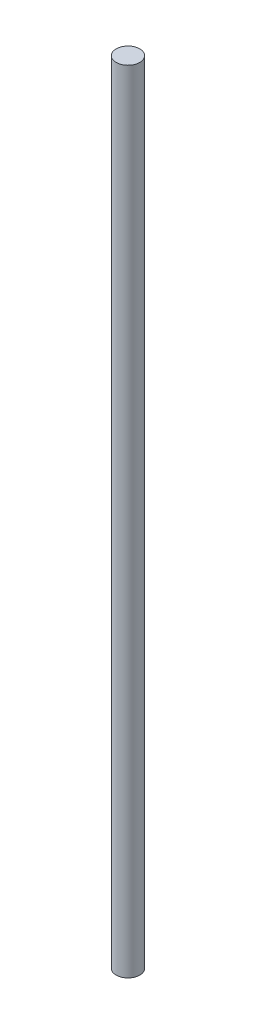
from build123d import *

# Parameters (mm, degrees)
SKETCH_1_R      = 1
EXTRUDE_1_DEPTH = 67


with BuildPart() as part:
    # 草图1 → 凸台-拉伸1 (new body)
    with BuildSketch(Plane(origin=(0, 0, 0), x_dir=(1, 0, 0), z_dir=(0, 1, 0))):
        with Locations(Location((0, 0, 0), (0, 0, 270))):
            Circle(SKETCH_1_R)
    extrude(amount=EXTRUDE_1_DEPTH)


solid = part.part
